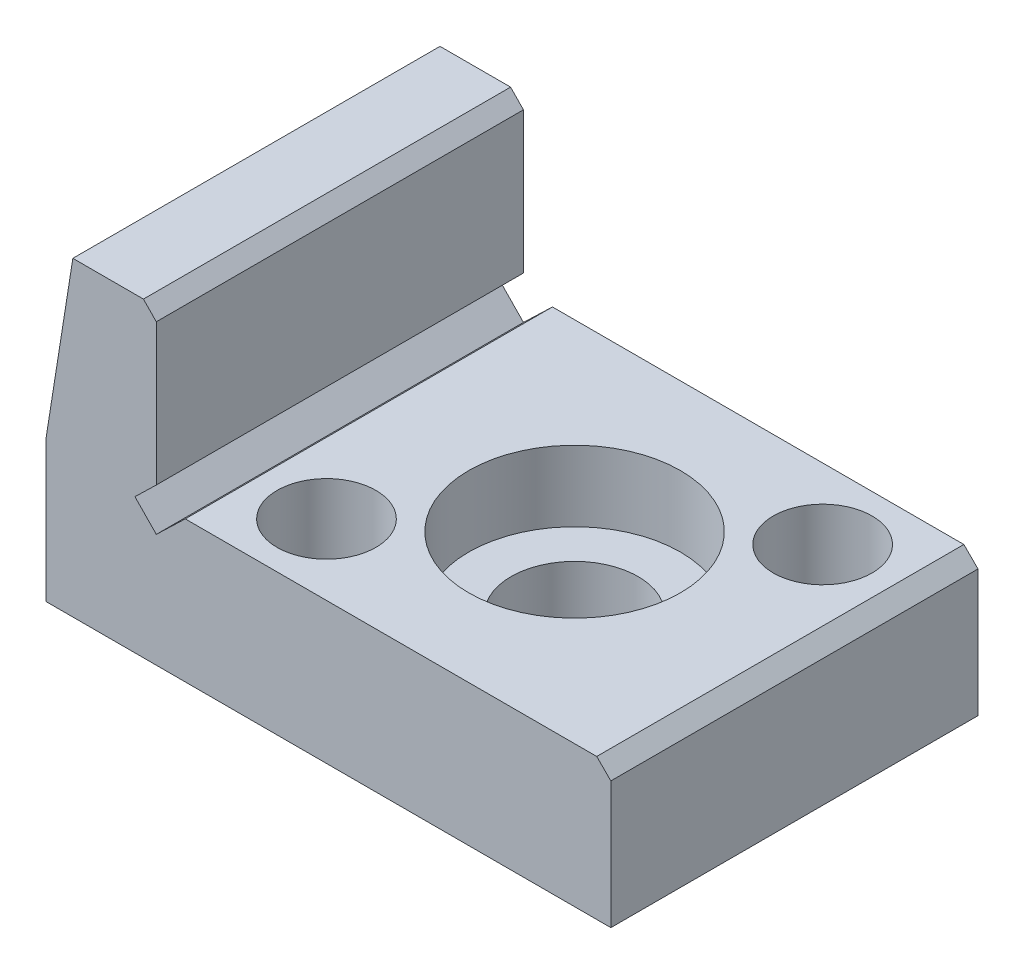
from build123d import *

# Parameters (mm, degrees)
EXTRUDE_1_DEPTH     = 26
SKETCH_2_R          = 3.5
SKETCH_2_R_2        = 4.5
CUT_EXTRUDE_1_DEPTH = 26
SKETCH_2_3_R        = 7.5
SKETCH_2_3_R_2      = 4.5
CUT_EXTRUDE_2_DEPTH = 5


with BuildPart() as part:
    # 草图1 → 凸台-拉伸1 (new body)
    with BuildSketch(Plane.XY):
        Polygon((0, 0), (40, 0), (40, 9), (39, 10), (9.862873216, 10), (7.811286052, 8.025146032), (6.29823885, 9.580536944), (7.811286052, 11.052393193), (7.811286052, 21.063841402), (6.900613284, 22), (1.900613284, 22), (0, 10), align=None)
    extrude(amount=EXTRUDE_1_DEPTH)

    # 草图2 → 切除-拉伸1 (cut)
    with BuildSketch(Plane(origin=(0, 10, 0), x_dir=(1, 0, 0), z_dir=(0, 1, 0))):
        with Locations((34, -5)):
            Circle(SKETCH_2_R)
        with Locations((24.431436608, -13)):
            Circle(SKETCH_2_R_2)
        with Locations((14.862873216, -21)):
            Circle(SKETCH_2_R)
    extrude(amount=-CUT_EXTRUDE_1_DEPTH, mode=Mode.SUBTRACT)

    # 草图2<3> → 切除-拉伸2 (cut)
    with BuildSketch(Plane(origin=(0, 10, 0), x_dir=(1, 0, 0), z_dir=(0, 1, 0))):
        with Locations((24.431436608, -13)):
            Circle(SKETCH_2_3_R)
        with Locations((24.431436608, -13)):
            Circle(SKETCH_2_3_R_2, mode=Mode.SUBTRACT)
    extrude(amount=-CUT_EXTRUDE_2_DEPTH, mode=Mode.SUBTRACT)


solid = part.part
